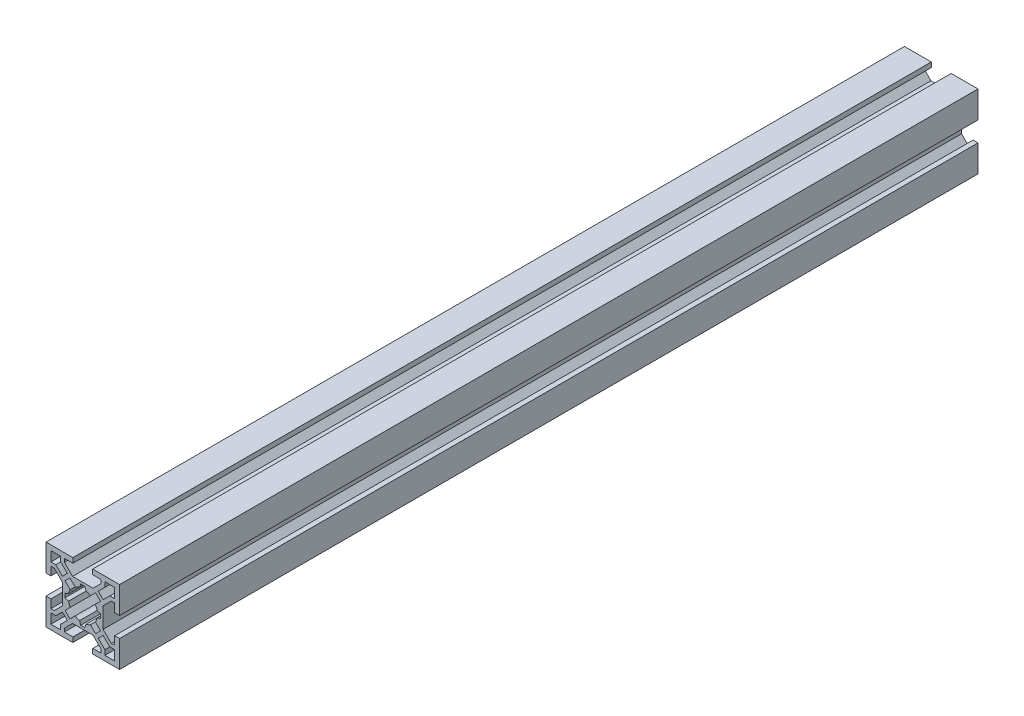
from build123d import *

# Parameters (mm, degrees)
RESSALTO_EXTRUS_O1_DEPTH = 175


with BuildPart() as part:
    # Esboço1 → Ressalto-extrusão1 (new, symmetric)
    with BuildSketch(Plane.XY):
        Polygon((-13, -4.05), (-15, -4.05), (-15, -15), (-4.05, -15), (-4.05, -13), (-7.5, -13), (-7.5, -11.627272727), (-4.172727273, -8.3), (4.172727273, -8.3), (7.5, -11.627272727), (7.5, -13), (4.05, -13), (4.05, -15), (15, -15), (15, -4.05), (13, -4.05), (13, -7.5), (11.627272727, -7.5), (8.3, -4.172727273), (8.3, 4.172727273), (11.627272727, 7.5), (13, 7.5), (13, 4.05), (15, 4.05), (15, 15), (4.05, 15), (4.05, 13), (7.5, 13), (7.5, 11.627272727), (4.172727273, 8.3), (-4.172727273, 8.3), (-7.5, 11.627272727), (-7.5, 13), (-4.05, 13), (-4.05, 15), (-15, 15), (-15, 4.05), (-13, 4.05), (-13, 7.5), (-11.627272727, 7.5), (-8.3, 4.172727273), (-8.3, -4.172727273), (-11.627272727, -7.5), (-13, -7.5), align=None)
        with BuildLine():
            Line((-7.239339828, -5.233387445), (-5.125358847, -3.119406464))
            ThreePointArc((-5.125358847, -3.119406464), (-5.566897716, -2.238224702), (-5.858217272, -1.296645823))
            Line((-5.858217272, -1.296645823), (-7.3, -0.859788435))
            Line((-7.3, -0.859788435), (-7.3, 0.859788435))
            Line((-7.3, 0.859788435), (-5.858217272, 1.296645823))
            ThreePointArc((-5.858217272, 1.296645823), (-5.566897716, 2.238224702), (-5.125358847, 3.119406464))
            Line((-5.125358847, 3.119406464), (-7.239339828, 5.233387445))
            Line((-7.239339828, 5.233387445), (-5.233387445, 7.239339828))
            Line((-5.233387445, 7.239339828), (-3.119406464, 5.125358847))
            ThreePointArc((-3.119406464, 5.125358847), (-2.238224702, 5.566897716), (-1.296645823, 5.858217272))
            Line((-1.296645823, 5.858217272), (-0.859788435, 7.3))
            Line((-0.859788435, 7.3), (0.859788435, 7.3))
            Line((0.859788435, 7.3), (1.296645823, 5.858217272))
            ThreePointArc((1.296645823, 5.858217272), (2.238224702, 5.566897716), (3.119406464, 5.125358847))
            Line((3.119406464, 5.125358847), (5.233387445, 7.239339828))
            Line((5.233387445, 7.239339828), (7.239339828, 5.233387445))
            Line((7.239339828, 5.233387445), (5.125358847, 3.119406464))
            ThreePointArc((5.125358847, 3.119406464), (5.566897716, 2.238224702), (5.858217272, 1.296645823))
            Line((5.858217272, 1.296645823), (7.3, 0.859788435))
            Line((7.3, 0.859788435), (7.3, -0.859788435))
            Line((7.3, -0.859788435), (5.858217272, -1.296645823))
            ThreePointArc((5.858217272, -1.296645823), (5.566897716, -2.238224702), (5.125358847, -3.119406464))
            Line((5.125358847, -3.119406464), (7.239339828, -5.233387445))
            Line((7.239339828, -5.233387445), (5.233387445, -7.239339828))
            Line((5.233387445, -7.239339828), (3.119406464, -5.125358847))
            ThreePointArc((3.119406464, -5.125358847), (2.238224702, -5.566897716), (1.296645823, -5.858217272))
            Line((1.296645823, -5.858217272), (0.859788435, -7.3))
            Line((0.859788435, -7.3), (-0.859788435, -7.3))
            Line((-0.859788435, -7.3), (-1.296645823, -5.858217272))
            ThreePointArc((-1.296645823, -5.858217272), (-2.238224702, -5.566897716), (-3.119406464, -5.125358847))
            Line((-3.119406464, -5.125358847), (-5.233387445, -7.239339828))
            Line((-5.233387445, -7.239339828), (-7.239339828, -5.233387445))
        make_face(mode=Mode.SUBTRACT)
        Polygon((-11.005952384, -9), (-13, -9), (-13, -13), (-9, -13), (-9, -11.005952384), (-6.294047616, -8.3), (-8.3, -6.294047616), align=None, mode=Mode.SUBTRACT)
        Polygon((9, -11.005952384), (9, -13), (13, -13), (13, -9), (11.005952384, -9), (8.3, -6.294047616), (6.294047616, -8.3), align=None, mode=Mode.SUBTRACT)
        Polygon((11.005952384, 9), (13, 9), (13, 13), (9, 13), (9, 11.005952384), (6.294047616, 8.3), (8.3, 6.294047616), align=None, mode=Mode.SUBTRACT)
        Polygon((-9, 11.005952384), (-9, 13), (-13, 13), (-13, 9), (-11.005952384, 9), (-8.3, 6.294047616), (-6.294047616, 8.3), align=None, mode=Mode.SUBTRACT)
    extrude(amount=RESSALTO_EXTRUS_O1_DEPTH, both=True)


solid = part.part
